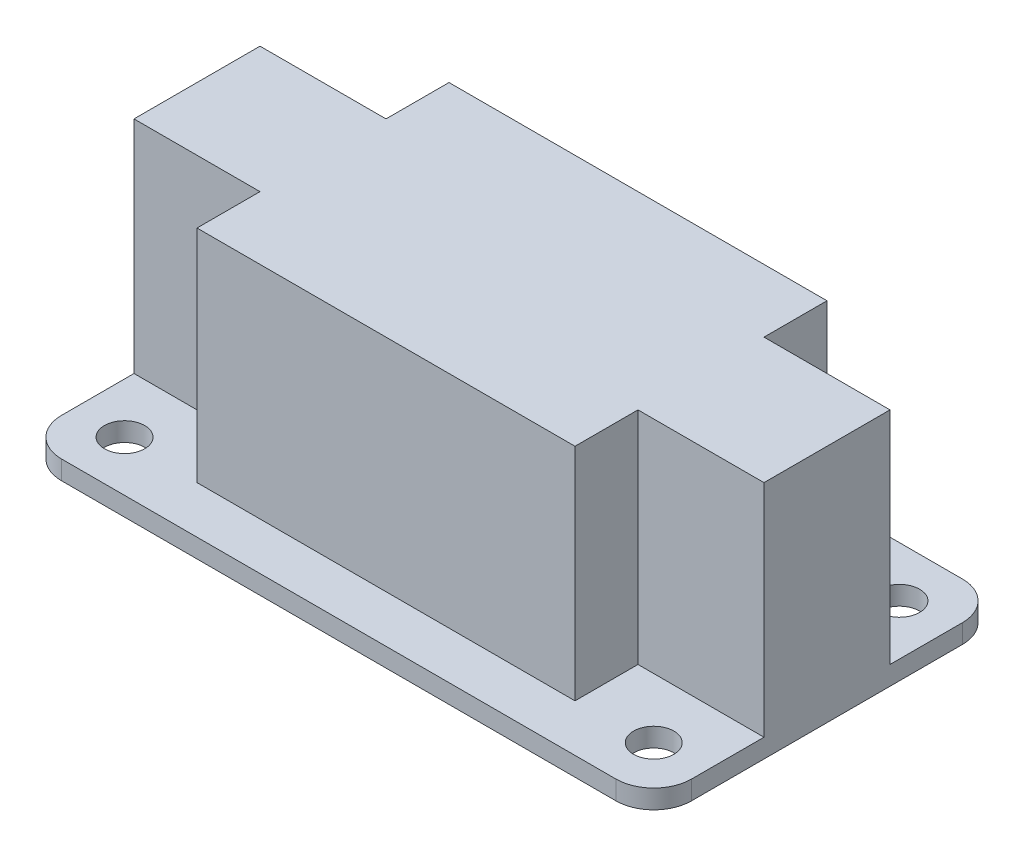
from build123d import *

# Parameters (mm, degrees)
SKETCH2_W           = 50
SKETCH2_H           = 27.5
SKETCH2_R           = 1.6
BOSS_EXTRUDE1_DEPTH = 1.5
FILLET1_R           = 3
SKETCH3_W           = 10
SKETCH3_H           = 10
BOSS_EXTRUDE2_DEPTH = 19


with BuildPart() as part:
    # Sketch2 → Boss-Extrude1 (new body)
    with BuildSketch(Plane(origin=(0, 0, 0), x_dir=(1, 0, 0), z_dir=(0, 1, 0))):
        with Locations((25, 13.75)):
            Rectangle(SKETCH2_W, SKETCH2_H)
        with Locations(Location((46, 23.5, 0), (0, 0, 270))):
            Circle(SKETCH2_R, mode=Mode.SUBTRACT)
        with Locations(Location((46, 4, 0), (0, 0, 270))):
            Circle(SKETCH2_R, mode=Mode.SUBTRACT)
        with Locations(Location((4, 23.5, 0), (0, 0, 270))):
            Circle(SKETCH2_R, mode=Mode.SUBTRACT)
        with Locations(Location((4, 4, 0), (0, 0, 270))):
            Circle(SKETCH2_R, mode=Mode.SUBTRACT)
    extrude(amount=BOSS_EXTRUDE1_DEPTH)

    # Fillet1
    fillet1_edges = [part.edges().sort_by_distance(p)[0] for p in [
        (0, 0.75, 0),
        (0, 0.75, -27.5),
        (50, 0.75, -27.5),
        (50, 0.75, 0),
    ]]
    fillet(fillet1_edges, radius=FILLET1_R)

    # Sketch3 → Boss-Extrude2 (add)
    with BuildSketch(Plane(origin=(0, 0, 0), x_dir=(1, 0, 0), z_dir=(0, 1, 0))):
        with Locations((5, 13.75)):
            Rectangle(SKETCH3_W, SKETCH3_H)
        Polygon((10, 18.75), (10, 8.75), (10, 3.75), (40, 3.75), (40, 8.75), (40, 18.75), (40, 23.75), (10, 23.75), align=None)
        with Locations((45, 13.75)):
            Rectangle(SKETCH3_W, SKETCH3_H)
    extrude(amount=BOSS_EXTRUDE2_DEPTH)


solid = part.part
